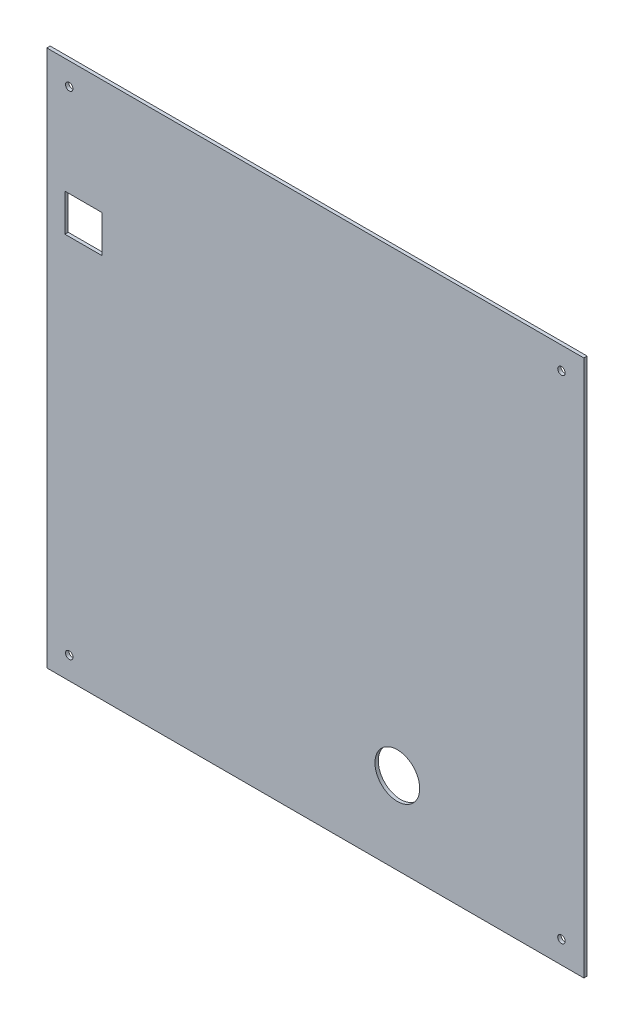
from build123d import *

# Parameters (mm, degrees)
SKETCH1_W           = 457.2
SKETCH1_H           = 457.2
BOSS_EXTRUDE1_DEPTH = 2.8321
SKETCH2_R           = 3.175
SKETCH2_R_2         = 19.05
SKETCH2_W           = 31.75
SKETCH2_H           = 31.75
CUT_EXTRUDE1_DEPTH  = 536.658532911


with BuildPart() as part:
    # Sketch1 → Boss-Extrude1 (new body)
    with BuildSketch(Plane.XY):
        with Locations((-50.8, -228.4095)):
            Rectangle(SKETCH1_W, SKETCH1_H)
    extrude(amount=BOSS_EXTRUDE1_DEPTH)

    # Sketch2 → Cut-Extrude1 (cut, through all)
    with BuildSketch(Plane.XY.offset(2.8321)):
        with Locations((-260.35, -18.8595)):
            Circle(SKETCH2_R)
        with Locations((-260.35, -437.9595)):
            Circle(SKETCH2_R)
        with Locations((158.75, -437.9595)):
            Circle(SKETCH2_R)
        with Locations((158.75, -18.8595)):
            Circle(SKETCH2_R)
        with Locations((19.00555, -387.1595)):
            Circle(SKETCH2_R_2)
        with Locations((-248.158, -113.6015)):
            Rectangle(SKETCH2_W, SKETCH2_H)
    extrude(amount=-CUT_EXTRUDE1_DEPTH, mode=Mode.SUBTRACT)


solid = part.part
